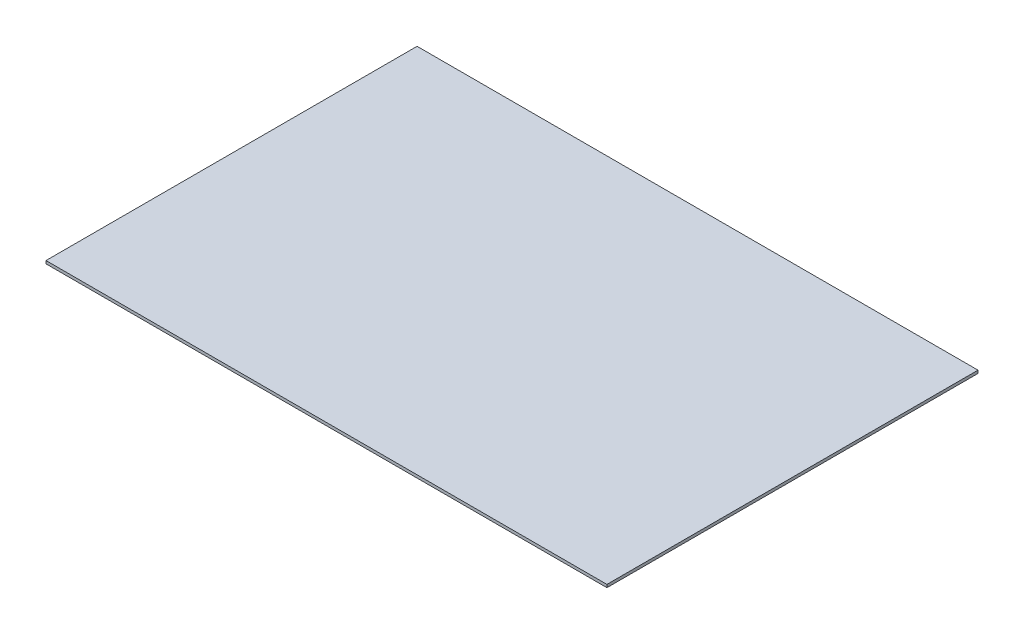
from build123d import *

# Parameters (mm, degrees)
SKETCH1_W           = 390
SKETCH1_H           = 258
BOSS_EXTRUDE1_DEPTH = 2


with BuildPart() as part:
    # Sketch1 → Boss-Extrude1 (new body)
    with BuildSketch(Plane(origin=(0, 0, 0), x_dir=(1, 0, 0), z_dir=(0, 1, 0))):
        with Locations((0, 1.5)):
            Rectangle(SKETCH1_W, SKETCH1_H)
    extrude(amount=BOSS_EXTRUDE1_DEPTH)


solid = part.part
